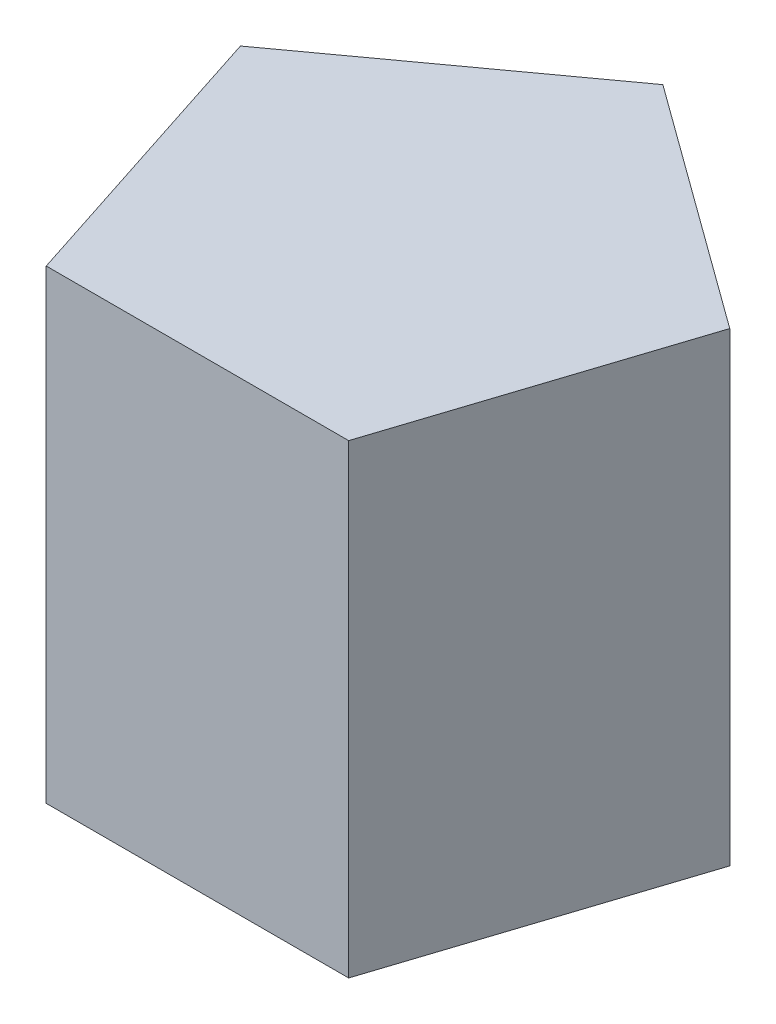
from build123d import *

# Parameters (mm, degrees)
BOSS_EXTRUDE1_DEPTH = 25


with BuildPart() as part:
    # Sketch1 → Boss-Extrude1 (new, symmetric)
    with BuildSketch(Plane(origin=(0, 0, 0), x_dir=(1, 0, 0), z_dir=(0, 1, 0))):
        Polygon((-26.286555606, 8.541019662), (-16.245984812, -22.360679775), (16.245984812, -22.360679775), (26.286555606, 8.541019662), (0, 27.639320225), align=None)
    extrude(amount=BOSS_EXTRUDE1_DEPTH, both=True)


solid = part.part
